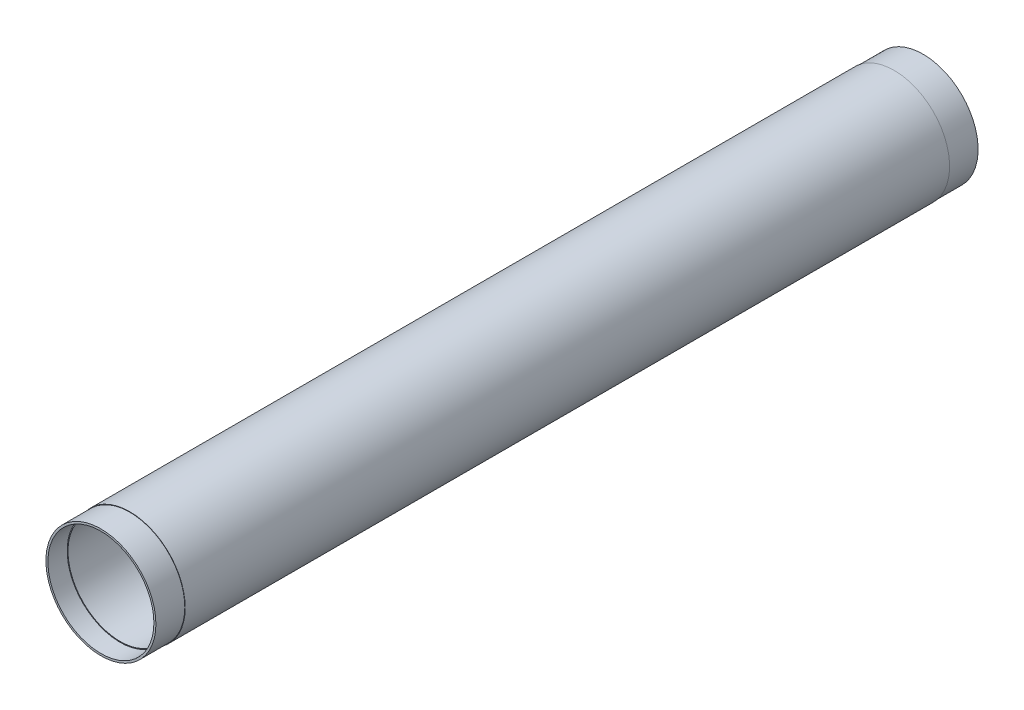
from build123d import *

# Parameters (mm, degrees)
SKETCH1_R           = 34.5
SKETCH1_R_2         = 32.5
BOSS_EXTRUDE1_DEPTH = 512
CUT_EXTRUDE1_START  = -12
SKETCH3_R           = 33
SKETCH3_R_2         = 32.5
CUT_EXTRUDE1_DEPTH  = 12
CUT_EXTRUDE3_START  = -18
SKETCH4_R           = 34.5
SKETCH4_R_2         = 34.25
CUT_EXTRUDE3_DEPTH  = 18
SKETCH5_R           = 34.5
SKETCH5_R_2         = 34.25
CUT_EXTRUDE4_DEPTH  = 18


with BuildPart() as part:
    # Sketch1 → Boss-Extrude1 (new body)
    with BuildSketch(Plane.XY):
        Circle(SKETCH1_R)
        Circle(SKETCH1_R_2, mode=Mode.SUBTRACT)
    extrude(amount=BOSS_EXTRUDE1_DEPTH)

    # Sketch3 → Cut-Extrude1 (cut)
    with BuildSketch(Plane.XY.offset(512).offset(CUT_EXTRUDE1_START)):
        Circle(SKETCH3_R)
        Circle(SKETCH3_R_2, mode=Mode.SUBTRACT)
    extrude(amount=CUT_EXTRUDE1_DEPTH, mode=Mode.SUBTRACT)

    # Sketch4 → Cut-Extrude3 (cut)
    with BuildSketch(Plane.XY.offset(512).offset(CUT_EXTRUDE3_START)):
        Circle(SKETCH4_R)
        Circle(SKETCH4_R_2, mode=Mode.SUBTRACT)
    extrude(amount=CUT_EXTRUDE3_DEPTH, mode=Mode.SUBTRACT)

    # Sketch5 → Cut-Extrude4 (cut)
    with BuildSketch(Plane(origin=(0, 0, 0), x_dir=(-1, 0, 0), z_dir=(0, 0, -1))):
        Circle(SKETCH5_R)
        with Locations(Location((0, 0, 0), (0, 0, 180))):
            Circle(SKETCH5_R_2, mode=Mode.SUBTRACT)
    extrude(amount=-CUT_EXTRUDE4_DEPTH, mode=Mode.SUBTRACT)


solid = part.part
